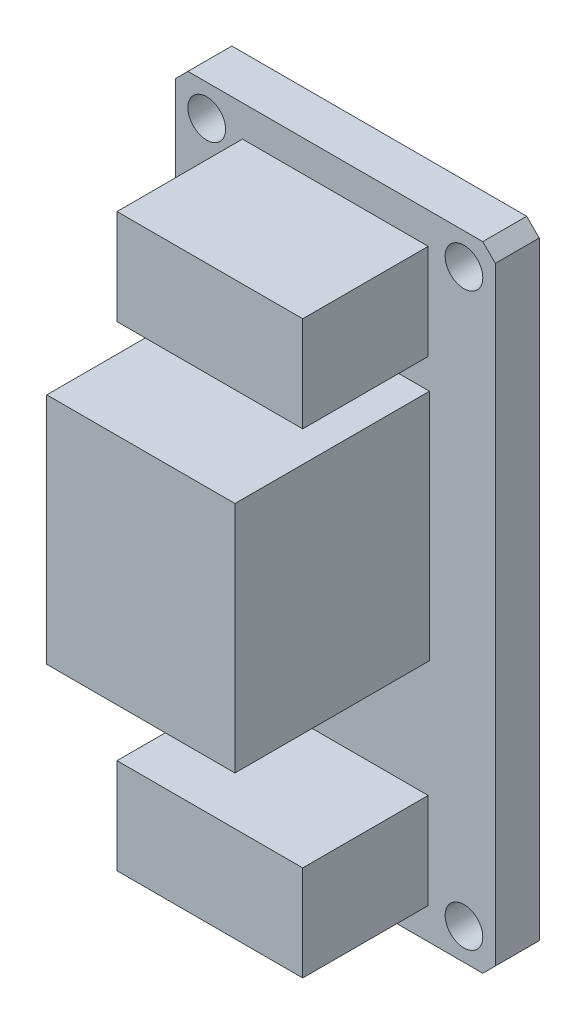
from build123d import *

# Parameters (mm, degrees)
SKETCH1_W           = 25.5
SKETCH1_H           = 50.5
SKETCH1_R           = 1.5
BOSS_EXTRUDE1_DEPTH = 3.5
SKETCH1_4_W         = 14.8
SKETCH1_4_H         = 7.6
BOSS_EXTRUDE2_DEPTH = 10
SKETCH1_6_W         = 15
SKETCH1_6_H         = 18.6
BOSS_EXTRUDE3_DEPTH = 15.5
CHAMFER1_SIZE       = 1


with BuildPart() as part:
    # Sketch1 → Boss-Extrude1 (new body)
    with BuildSketch(Plane.XY):
        with Locations((12.75, 25.25)):
            Rectangle(SKETCH1_W, SKETCH1_H)
        with Locations((2.5, 2.5)):
            Circle(SKETCH1_R, mode=Mode.SUBTRACT)
        with Locations((23, 2.5)):
            Circle(SKETCH1_R, mode=Mode.SUBTRACT)
        with Locations((2.5, 48)):
            Circle(SKETCH1_R, mode=Mode.SUBTRACT)
        with Locations((23, 48)):
            Circle(SKETCH1_R, mode=Mode.SUBTRACT)
    extrude(amount=-BOSS_EXTRUDE1_DEPTH)

    # Sketch1<4> → Boss-Extrude2 (add)
    with BuildSketch(Plane.XY):
        with Locations((12.75, 44.2)):
            Rectangle(SKETCH1_4_W, SKETCH1_4_H)
        with Locations((12.75, 6.3)):
            Rectangle(SKETCH1_4_W, SKETCH1_4_H)
    extrude(amount=BOSS_EXTRUDE2_DEPTH)

    # Sketch1<6> → Boss-Extrude3 (add)
    with BuildSketch(Plane.XY):
        with Locations((12.75, 28.74855078)):
            Rectangle(SKETCH1_6_W, SKETCH1_6_H)
    extrude(amount=BOSS_EXTRUDE3_DEPTH)

    # Chamfer1
    chamfer1_edges = [part.edges().sort_by_distance(p)[0] for p in [
        (25.5, 0, -1.75),
        (0, 0, -1.75),
        (25.5, 50.5, -1.75),
        (0, 50.5, -1.75),
    ]]
    chamfer(chamfer1_edges, length=CHAMFER1_SIZE)


solid = part.part
